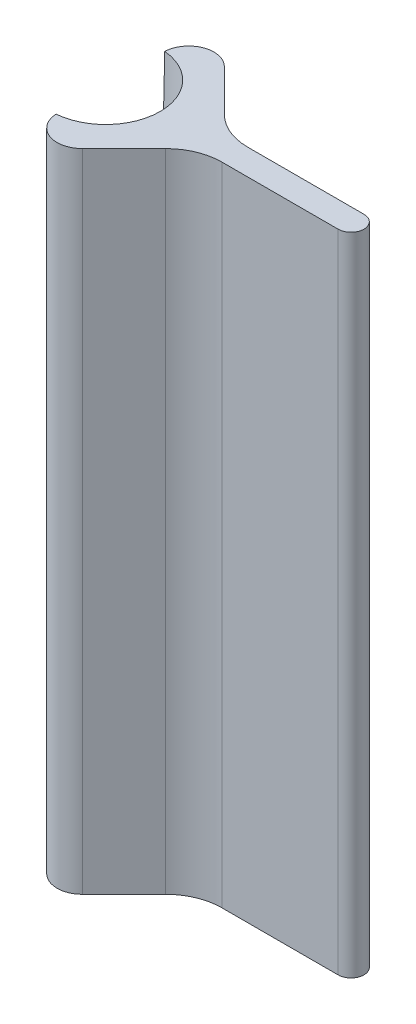
from build123d import *

# Parameters (mm, degrees)
BOSS_EXTRUDE2_DEPTH = 10
SKETCH5_R           = 0.635
CUT_EXTRUDE1_DEPTH  = 10
CUT_EXTRUDE1_DRAFT  = 1.2


with BuildPart() as part:
    # Sketch2 → Boss-Extrude2 (new body)
    with BuildSketch(Plane(origin=(0, 0, 0), x_dir=(1, 0, 0), z_dir=(0, 1, 0))):
        with BuildLine():
            Line((0.055343897, 0.632583633), (0.075113859, 0.858555332))
            ThreePointArc((0.075113859, 0.858555332), (0.329887136, 1.190582332), (0.738477631, 1.1))
            Line((0.738477631, 1.1), (1.382842712, 0.455634919))
            ThreePointArc((1.382842712, 0.455634919), (1.665996883, 0.266437351), (2, 0.2))
            Line((2, 0.2), (3.8, 0.2))
            ThreePointArc((3.8, 0.2), (4, 0), (3.8, -0.2))
            Line((3.8, -0.2), (2, -0.2))
            ThreePointArc((2, -0.2), (1.665996883, -0.266437351), (1.382842712, -0.455634919))
            Line((1.382842712, -0.455634919), (0.738477631, -1.1))
            ThreePointArc((0.738477631, -1.1), (0.329887136, -1.190582332), (0.075113859, -0.858555332))
            Line((0.075113859, -0.858555332), (0.055343897, -0.632583633))
            Line((0.055343897, -0.632583633), (0.055343897, 0.632583633))
        make_face()
    extrude(amount=BOSS_EXTRUDE2_DEPTH)


with BuildPart() as cut_extrude1_tool:
    # Sketch5 → Cut-Extrude1 (with draft: the straight prism first)
    with BuildSketch(Plane.XZ):
        Circle(SKETCH5_R)
    extrude(amount=-CUT_EXTRUDE1_DEPTH)
    # Cut-Extrude1: the draft: its side faces are tilted about the plane it starts from
    cut_extrude1_sides = [cut_extrude1_tool.faces().sort_by_distance(p)[0] for p in [
        (-0.635, 5, 0),
    ]]
    draft(cut_extrude1_sides, Plane.XZ, CUT_EXTRUDE1_DRAFT)


with BuildPart() as part_1:
    add(part.part)

    # Cut-Extrude1: cut by cut_extrude1_tool
    add(cut_extrude1_tool.part, mode=Mode.SUBTRACT)


solid = part_1.part
